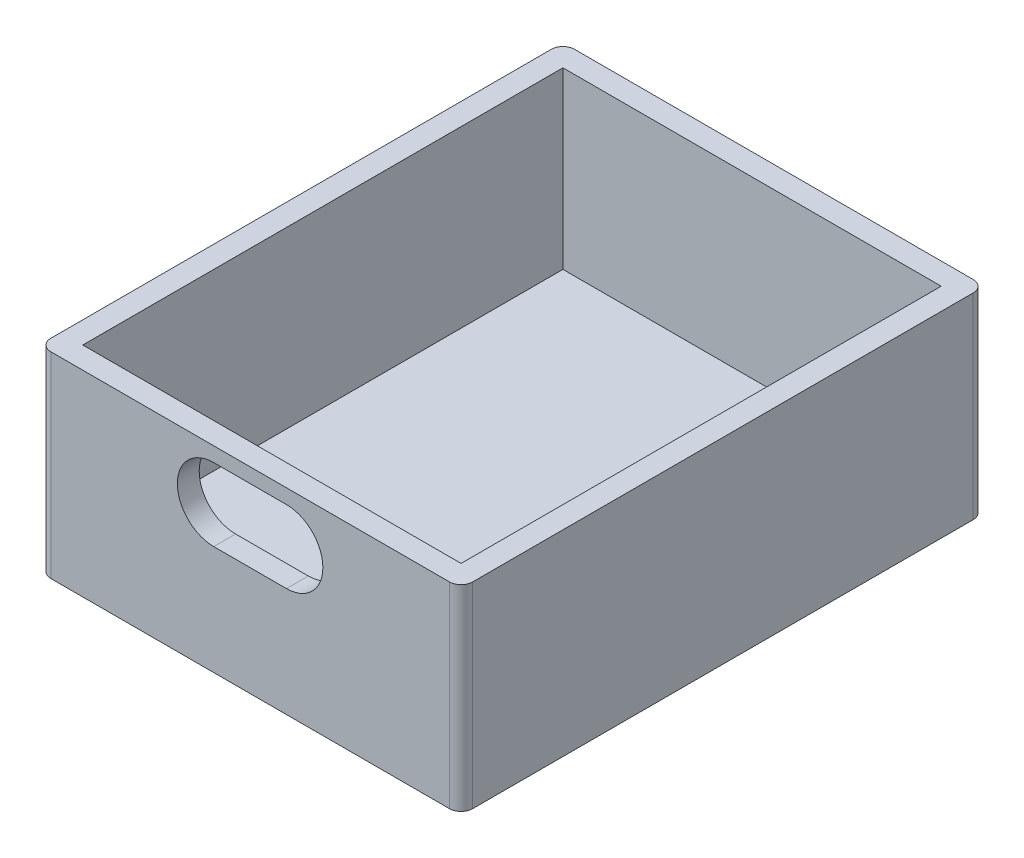
from build123d import *

# Parameters (mm, degrees)
SKETCH1_W           = 29
SKETCH1_H           = 13.5
BOSS_EXTRUDE1_DEPTH = 36
SKETCH2_W           = 26
SKETCH2_H           = 33
CUT_EXTRUDE1_DEPTH  = 12
CUT_EXTRUDE2_DEPTH  = 1.5
FILLET1_R           = 0.8


with BuildPart() as part:
    # Sketch1 → Boss-Extrude1 (new body)
    with BuildSketch(Plane.XY):
        with Locations((14.5, -6.75)):
            Rectangle(SKETCH1_W, SKETCH1_H)
    extrude(amount=BOSS_EXTRUDE1_DEPTH)

    # Sketch2 → Cut-Extrude1 (cut)
    with BuildSketch(Plane(origin=(0, 0, 0), x_dir=(1, 0, 0), z_dir=(0, 1, 0))):
        with Locations((14.5, -18)):
            Rectangle(SKETCH2_W, SKETCH2_H)
    extrude(amount=-CUT_EXTRUDE1_DEPTH, mode=Mode.SUBTRACT)

    # Sketch3 → Cut-Extrude2 (cut)
    with BuildSketch(Plane.XY.offset(36)):
        with BuildLine():
            Line((12, -1), (17, -1))
            ThreePointArc((17, -1), (19.5, -3.5), (17, -6))
            Line((17, -6), (12, -6))
            ThreePointArc((12, -6), (9.5, -3.5), (12, -1))
        make_face()
    extrude(amount=-CUT_EXTRUDE2_DEPTH, mode=Mode.SUBTRACT)

    # Fillet1
    fillet1_edges = [part.edges().sort_by_distance(p)[0] for p in [
        (29, -6.75, 36),
        (0, -6.75, 36),
        (29, -6.75, 0),
        (0, -6.75, 0),
    ]]
    fillet(fillet1_edges, radius=FILLET1_R)


solid = part.part
